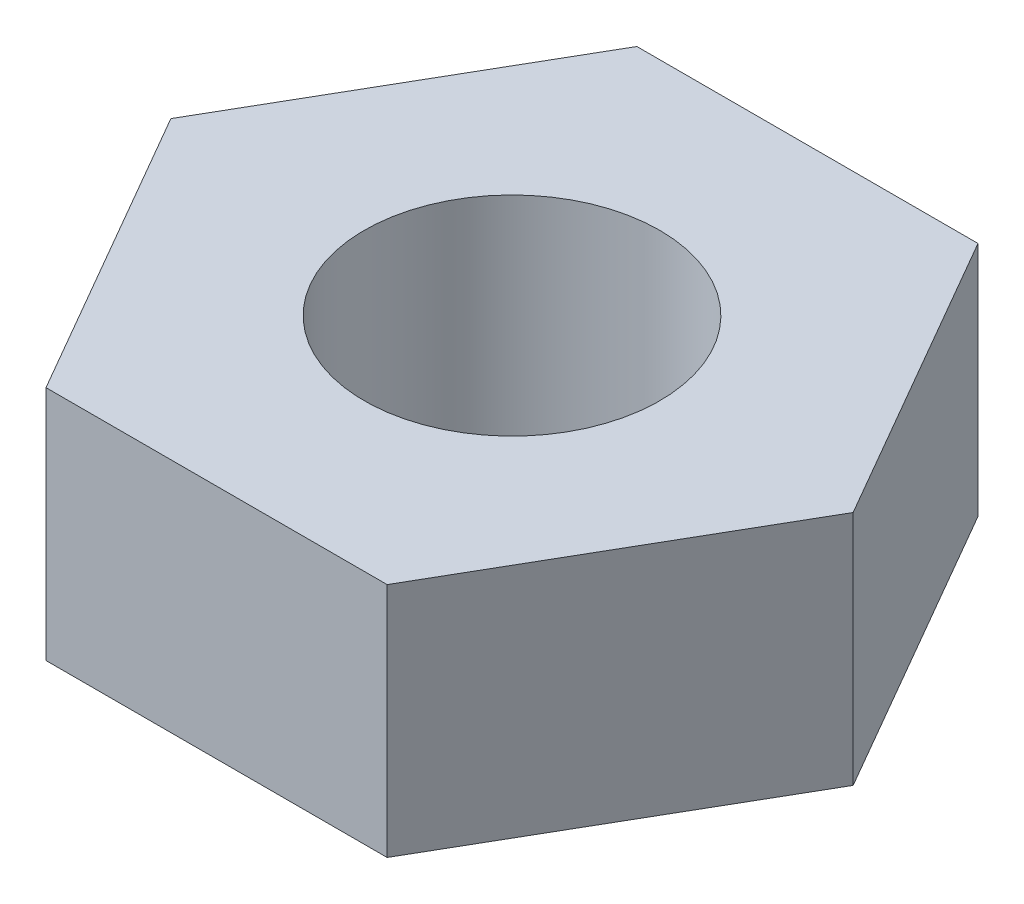
from build123d import *

# Parameters (mm, degrees)
EXTRUDE_1_DEPTH     = 2
SKETCH_3_R          = 1.25
CUT_EXTRUDE_1_DEPTH = 5.310839052


with BuildPart() as part:
    # 草图1 → 凸台-拉伸1 (new body)
    with BuildSketch(Plane(origin=(0, 0, 0), x_dir=(1, 0, 0), z_dir=(0, 1, 0))):
        Polygon((2.886751346, 0), (1.443375673, 2.5), (-1.443375673, 2.5), (-2.886751346, 0), (-1.443375673, -2.5), (1.443375673, -2.5), align=None)
    extrude(amount=EXTRUDE_1_DEPTH)

    # 草图3 → 切除-拉伸1 (cut, through all)
    with BuildSketch(Plane.XZ):
        Circle(SKETCH_3_R)
    extrude(amount=-CUT_EXTRUDE_1_DEPTH, mode=Mode.SUBTRACT)


solid = part.part
